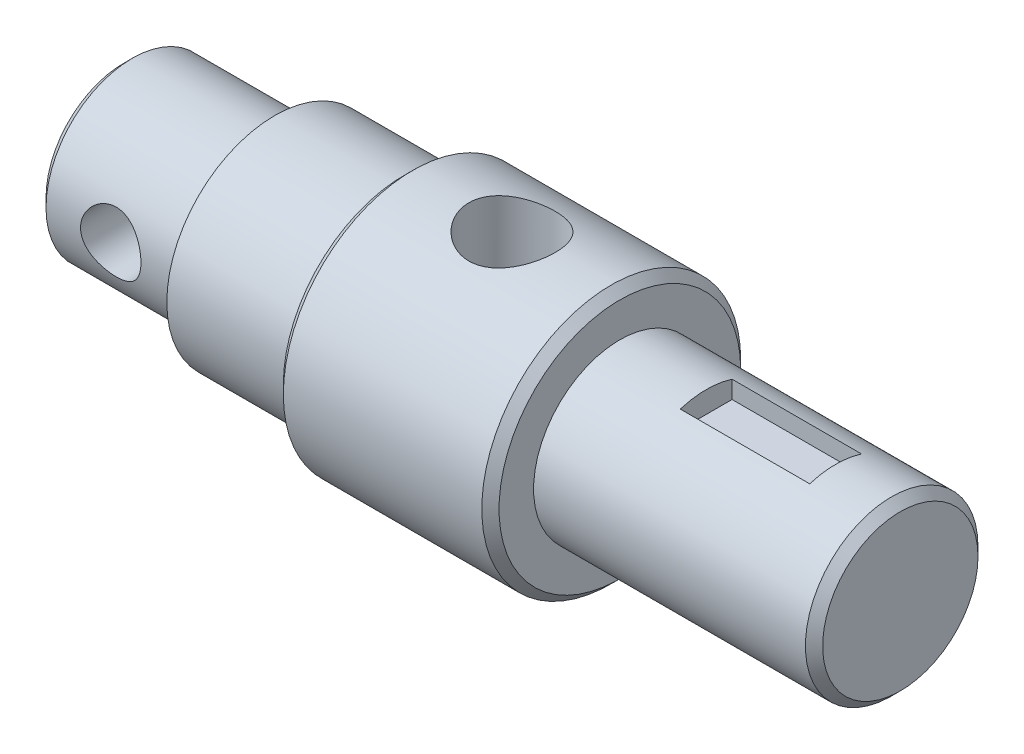
from build123d import *

# Parameters (mm, degrees)
SKETCH_2_W               = 30
SKETCH_2_H               = 5
CUT_EXTRUDE_1_DEPTH      = 6
CUT_EXTRUDE_2_DEPTH      = 185.932420089
CUT_EXTRUDE_2_DEPTH_BACK = 185.932420089
SKETCH_3_R               = 7
PATTERN_CIRCULAR_1_COUNT = 2
CHAMFER_1_SIZE           = 2


with BuildPart() as part:
    # Эскиз1 → Повернуть1 (revolve)
    with BuildSketch(Plane.XY, mode=Mode.PRIVATE) as revolve_1_sk:
        Polygon((0, 0), (0, 20), (35, 20), (35, 25), (65, 25), (65, 30), (115, 30), (115, 20), (180, 20), (180, 0), align=None)
    revolve(revolve_1_sk.sketch.rotate(Axis((0, 0, 0), (-1, 0, 0)), 90), axis=Axis((0, 0, 0), (-1, 0, 0)))

    # Эскиз2 → Вырез-Вытянуть1 (cut, symmetric)
    with BuildSketch(Plane.XY):
        with Locations((150, 17.5)):
            Rectangle(SKETCH_2_W, SKETCH_2_H)
    extrude(amount=CUT_EXTRUDE_1_DEPTH, both=True, mode=Mode.SUBTRACT)

    # Эскиз3 → Вырез-Вытянуть2 (cut, two sides: drawn at the far end of the back side and taken through both)
    with BuildSketch(Plane.XY.offset(-CUT_EXTRUDE_2_DEPTH_BACK)):
        with Locations((17, 0)):
            Circle(SKETCH_3_R)
    extrude(amount=CUT_EXTRUDE_2_DEPTH + CUT_EXTRUDE_2_DEPTH_BACK, mode=Mode.SUBTRACT)

    # Эскиз4 → Диаметр отверстия Ø16.0 (20)1 (revolve, cut)
    with BuildSketch(Plane(origin=(90, 30, 0), x_dir=(0, 0, 1), z_dir=(1, 0, 0))):
        Polygon((0, 0), (0, 26.00860619), (10, 20), (10, 0), align=None)
    hole_wizard_16_0_20_1 = revolve(axis=Axis((90, 36.35, 0), (0, -1, 0)), mode=Mode.SUBTRACT)

    # Круговой массив1: Диаметр отверстия Ø16.0 (20)1 ×2 about axis
    pattern_circular_1_axis = Axis((0, 0, 0), (1, 0, 0))
    for i in range(1, PATTERN_CIRCULAR_1_COUNT):
        add(hole_wizard_16_0_20_1.rotate(pattern_circular_1_axis, i * 360 / PATTERN_CIRCULAR_1_COUNT), mode=Mode.SUBTRACT)

    # Фаска1
    chamfer_1_edges = [part.edges().sort_by_distance(p)[0] for p in [
        (0, 0, 20),
        (180, 0, 20),
        (115, 0, 30),
        (65, 0, 30),
    ]]
    chamfer(chamfer_1_edges, length=CHAMFER_1_SIZE)


solid = part.part
